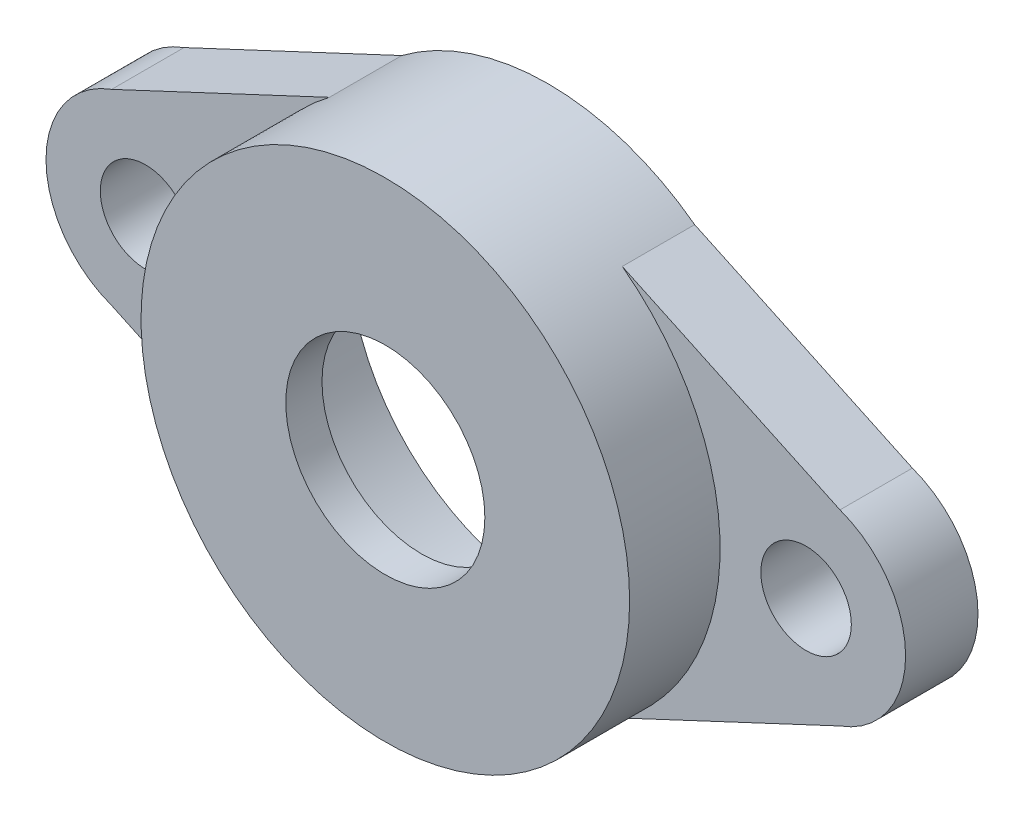
from build123d import *

# Parameters (mm, degrees)
ESBO_O1_R                = 4
ESBO_O1_R_2              = 2.5
RESSALTO_EXTRUS_O1_DEPTH = 4
ESBO_O2_R                = 12.015701032
ESBO_O2_R_2              = 10.48384183
RESSALTO_EXTRUS_O2_DEPTH = 5
ESBO_O3_R                = 5.5
ESBO_O3_R_2              = 4
RESSALTO_EXTRUS_O3_DEPTH = 9
BOSS_EXTRUDE1_START      = -5
SKETCH1_R                = 13.5
BOSS_EXTRUDE1_DEPTH      = 5
SKETCH2_R                = 11
CUT_EXTRUDE1_DEPTH       = 7
CUT_EXTRUDE2_START       = -7
SKETCH3_R                = 5.5
CUT_EXTRUDE2_DEPTH       = 7


with BuildPart() as part:
    # Esboço1 → Ressalto-extrusão1 (new body)
    with BuildSketch(Plane.XY):
        with BuildLine():
            Line((-20.12399727, 5.170892982), (-8.093718556, 10.80470823))
            ThreePointArc((-8.093718556, 10.80470823), (0, 13.5), (8.093718556, 10.80470823))
            Line((8.093718556, 10.80470823), (20.12399727, 5.170892982))
            ThreePointArc((20.12399727, 5.170892982), (23.75, 0), (20.12399727, -5.170892982))
            Line((20.12399727, -5.170892982), (8.093718556, -10.80470823))
            ThreePointArc((8.093718556, -10.80470823), (0, -13.5), (-8.093718556, -10.80470823))
            Line((-8.093718556, -10.80470823), (-20.12399727, -5.170892982))
            ThreePointArc((-20.12399727, -5.170892982), (-23.75, 0), (-20.12399727, 5.170892982))
        make_face()
        Circle(ESBO_O1_R, mode=Mode.SUBTRACT)
        with Locations((-18.25, 0)):
            Circle(ESBO_O1_R_2, mode=Mode.SUBTRACT)
        with Locations((18.25, 0)):
            Circle(ESBO_O1_R_2, mode=Mode.SUBTRACT)
    extrude(amount=RESSALTO_EXTRUS_O1_DEPTH)

    # Esboço2 → Ressalto-extrusão2 (add)
    with BuildSketch(Plane.XY.offset(4)):
        Circle(ESBO_O2_R)
        Circle(ESBO_O2_R_2, mode=Mode.SUBTRACT)
    extrude(amount=RESSALTO_EXTRUS_O2_DEPTH)

    # Esboço3 → Ressalto-extrusão3 (add)
    with BuildSketch(Plane.XY.offset(4)):
        Circle(ESBO_O3_R)
        Circle(ESBO_O3_R_2, mode=Mode.SUBTRACT)
    extrude(amount=RESSALTO_EXTRUS_O3_DEPTH)

    # Sketch1 → Boss-Extrude1 (add)
    with BuildSketch(Plane.XY.offset(9).offset(BOSS_EXTRUDE1_START)):
        with Locations(Location((0, 0, 0), (0, 0, 126.836580816))):
            Circle(SKETCH1_R)
    extrude(amount=BOSS_EXTRUDE1_DEPTH)

    # Sketch2 → Cut-Extrude1 (cut)
    with BuildSketch(Plane(origin=(0, 0, 0), x_dir=(-1, 0, 0), z_dir=(0, 0, -1))):
        Circle(SKETCH2_R)
    extrude(amount=-CUT_EXTRUDE1_DEPTH, mode=Mode.SUBTRACT)

    # Sketch3 → Cut-Extrude2 (cut)
    with BuildSketch(Plane.XY.offset(13).offset(CUT_EXTRUDE2_START)):
        Circle(SKETCH3_R)
    extrude(amount=CUT_EXTRUDE2_DEPTH, mode=Mode.SUBTRACT)


solid = part.part
